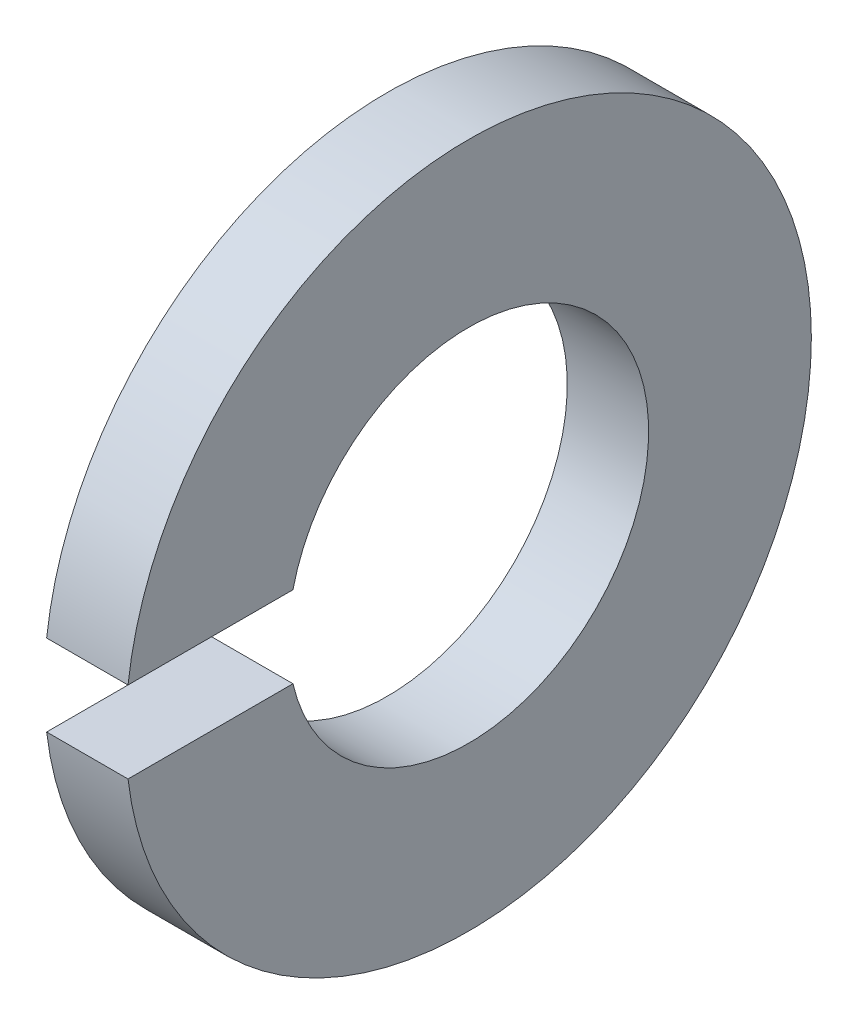
from build123d import *

# Parameters (mm, degrees)
SKETCH1_W          = 0.7
SKETCH1_H          = 1.4
CUT_EXTRUDE1_DEPTH = 5.23024822


with BuildPart() as part:
    # Sketch1 → Revolve1 (revolve)
    with BuildSketch(Plane.XY, mode=Mode.PRIVATE) as revolve1_sk:
        with Locations((-0.35, 2.25)):
            Rectangle(SKETCH1_W, SKETCH1_H)
    revolve(revolve1_sk.sketch.rotate(Axis((-0.7, 0, 0), (1, 0, 0)), 90), axis=Axis((-0.7, 0, 0), (1, 0, 0)))

    # Sketch2 → Cut-Extrude1 (cut, through all)
    with BuildSketch(Plane(origin=(0, 0, 0), x_dir=(0, 0, -1), z_dir=(1, 0, 0))):
        with BuildLine():
            Line((-1.509966887, -0.35), (-2.929163703, -0.35))
            ThreePointArc((-2.929163703, -0.35), (-2.95, 0), (-2.929163703, 0.35))
            Line((-2.929163703, 0.35), (-1.509966887, 0.35))
            ThreePointArc((-1.509966887, 0.35), (-1.55, 0), (-1.509966887, -0.35))
        make_face()
    extrude(amount=-CUT_EXTRUDE1_DEPTH, mode=Mode.SUBTRACT)


solid = part.part
